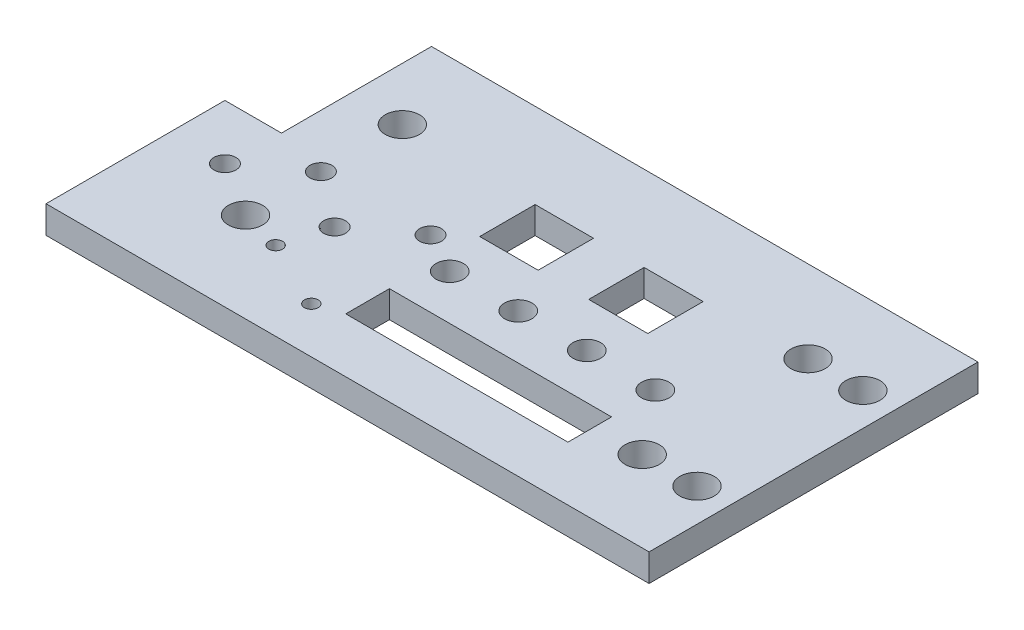
from build123d import *

# Parameters (mm, degrees)
SKETCH1_W                    = 220
SKETCH1_H                    = 120
BOSS_EXTRUDE1_DEPTH          = 10
CUT_EXTRUDE1_REACH           = 127.698
SKETCH2_W                    = 20.632503002
SKETCH2_H                    = 54.730004003
F_12_5_12_5_DIAMETER_HOLE1_D = 12.5
F_10_0_10_DIAMETER_HOLE1_D   = 10
F_5_0MM_DOWEL_HOLE1_D        = 5
CUT_EXTRUDE2_REACH           = 127.698
SKETCH12_R                   = 4
SKETCH12_W                   = 81.05559148
SKETCH12_H                   = 15.93559148
SKETCH12_W_2                 = 21.30559148
SKETCH12_H_2                 = 20.21559148
SKETCH12_W_3                 = 21.55559148
DRAFT1_ANGLE                 = -1


with BuildPart() as part:
    # Sketch1 → Boss-Extrude1 (new body)
    with BuildSketch(Plane(origin=(0, 0, 0), x_dir=(1, 0, 0), z_dir=(0, 1, 0))):
        Rectangle(SKETCH1_W, SKETCH1_H)
    extrude(amount=-BOSS_EXTRUDE1_DEPTH)

    # Sketch2 → Cut-Extrude1 (cut, up to next)
    with BuildSketch(Plane(origin=(0, 0, 0), x_dir=(1, 0, 0), z_dir=(0, 1, 0)), mode=Mode.PRIVATE) as cut_extrude1_sk1:
        with Locations((-99.683748499, 32.634997999)):
            Rectangle(SKETCH2_W, SKETCH2_H)
    cut_extrude1_tool1 = extrude(cut_extrude1_sk1.sketch, amount=-CUT_EXTRUDE1_REACH, mode=Mode.PRIVATE) & part.part
    add(cut_extrude1_tool1.solids().sort_by_distance((-99.683748, 0, -32.634998))[0], mode=Mode.SUBTRACT)

    # Ø12.5 (12.5) Diameter Hole1 (through all)
    with Locations(Plane(origin=(0, -10, 0), x_dir=(-1, 0, 0), z_dir=(0, -1, 0))):
        with Locations((-98, 30), (-78, 30), (70, 30), (-98, -30.5), (-78, -30.5), (70, -27.22)):
            Hole(F_12_5_12_5_DIAMETER_HOLE1_D / 2)

    # Ø10.0 (10) Diameter Hole1 (through all)
    with Locations(Plane(origin=(0, -10, 0), x_dir=(-1, 0, 0), z_dir=(0, -1, 0))):
        with Locations((-60, -7.72), (-35, -7.72), (-10, -7.72), (15, -7.72)):
            Hole(F_10_0_10_DIAMETER_HOLE1_D / 2)

    # Ø5.0mm Dowel Hole1 (through all)
    with Locations(Plane(origin=(0, -10, 0), x_dir=(-1, 0, 0), z_dir=(0, -1, 0))):
        with Locations((30, -43.22), (55, -31.22)):
            Hole(F_5_0MM_DOWEL_HOLE1_D / 2)

    # Sketch12 → Cut-Extrude2 (cut, up to next)
    with BuildSketch(Plane.XZ.offset(10), mode=Mode.PRIVATE) as cut_extrude2_sk1:
        with Locations(Location((-90, 14.72, 0), (0, 0, 270))):
            Circle(SKETCH12_R)
    cut_extrude2_tool1 = extrude(cut_extrude2_sk1.sketch, amount=-CUT_EXTRUDE2_REACH, mode=Mode.PRIVATE) & part.part
    # Sketch12 → Cut-Extrude2 (cut, up to next)
    with BuildSketch(Plane.XZ.offset(10), mode=Mode.PRIVATE) as cut_extrude2_sk2:
        with Locations(Location((-70, -0.28, 0), (0, 0, 270))):
            Circle(SKETCH12_R)
    cut_extrude2_tool2 = extrude(cut_extrude2_sk2.sketch, amount=-CUT_EXTRUDE2_REACH, mode=Mode.PRIVATE) & part.part
    # Sketch12 → Cut-Extrude2 (cut, up to next)
    with BuildSketch(Plane.XZ.offset(10), mode=Mode.PRIVATE) as cut_extrude2_sk3:
        with Locations(Location((-50, 14.72, 0), (0, 0, 270))):
            Circle(SKETCH12_R)
    cut_extrude2_tool3 = extrude(cut_extrude2_sk3.sketch, amount=-CUT_EXTRUDE2_REACH, mode=Mode.PRIVATE) & part.part
    # Sketch12 → Cut-Extrude2 (cut, up to next)
    with BuildSketch(Plane.XZ.offset(10), mode=Mode.PRIVATE) as cut_extrude2_sk4:
        with Locations(Location((-30, -0.28, 0), (0, 0, 270))):
            Circle(SKETCH12_R)
    cut_extrude2_tool4 = extrude(cut_extrude2_sk4.sketch, amount=-CUT_EXTRUDE2_REACH, mode=Mode.PRIVATE) & part.part
    # Sketch12 → Cut-Extrude2 (cut, up to next)
    with BuildSketch(Plane.XZ.offset(10), mode=Mode.PRIVATE) as cut_extrude2_sk5:
        with Locations((20, 32.16)):
            Rectangle(SKETCH12_W, SKETCH12_H)
    cut_extrude2_tool5 = extrude(cut_extrude2_sk5.sketch, amount=-CUT_EXTRUDE2_REACH, mode=Mode.PRIVATE) & part.part
    # Sketch12 → Cut-Extrude2 (cut, up to next)
    with BuildSketch(Plane.XZ.offset(10), mode=Mode.PRIVATE) as cut_extrude2_sk6:
        with Locations((-9.875, -18.86)):
            Rectangle(SKETCH12_W_2, SKETCH12_H_2)
    cut_extrude2_tool6 = extrude(cut_extrude2_sk6.sketch, amount=-CUT_EXTRUDE2_REACH, mode=Mode.PRIVATE) & part.part
    # Sketch12 → Cut-Extrude2 (cut, up to next)
    with BuildSketch(Plane.XZ.offset(10), mode=Mode.PRIVATE) as cut_extrude2_sk7:
        with Locations((30, -18.86)):
            Rectangle(SKETCH12_W_3, SKETCH12_H_2)
    cut_extrude2_tool7 = extrude(cut_extrude2_sk7.sketch, amount=-CUT_EXTRUDE2_REACH, mode=Mode.PRIVATE) & part.part
    add(cut_extrude2_tool1.solids().sort_by_distance((-90, -10, 14.72))[0], mode=Mode.SUBTRACT)
    add(cut_extrude2_tool2.solids().sort_by_distance((-70, -10, -0.28))[0], mode=Mode.SUBTRACT)
    add(cut_extrude2_tool3.solids().sort_by_distance((-50, -10, 14.72))[0], mode=Mode.SUBTRACT)
    add(cut_extrude2_tool4.solids().sort_by_distance((-30, -10, -0.28))[0], mode=Mode.SUBTRACT)
    add(cut_extrude2_tool5.solids().sort_by_distance((20, -10, 32.16))[0], mode=Mode.SUBTRACT)
    add(cut_extrude2_tool6.solids().sort_by_distance((-9.875, -10, -18.86))[0], mode=Mode.SUBTRACT)
    add(cut_extrude2_tool7.solids().sort_by_distance((30, -10, -18.86))[0], mode=Mode.SUBTRACT)

    # Draft1
    draft1_faces = [part.faces().sort_by_distance(p)[0] for p in [
        (60.52779574, -5, 32.16),
        (20, -5, 40.12779574),
        (-20.52779574, -5, 32.16),
        (20, -5, 24.19220426),
        (-9.875, -5, -8.75220426),
        (30, -5, -8.75220426),
        (40.77779574, -5, -18.86),
        (0.77779574, -5, -18.86),
        (-20.52779574, -5, -18.86),
        (19.22220426, -5, -18.86),
        (30, -5, -28.96779574),
        (-9.875, -5, -28.96779574),
        (-50, -5, 18.72),
        (-30, -5, 3.72),
        (-70, -5, 3.72),
        (-90, -5, 18.72),
    ]]
    draft(draft1_faces, Plane.ZX, DRAFT1_ANGLE)


solid = part.part
